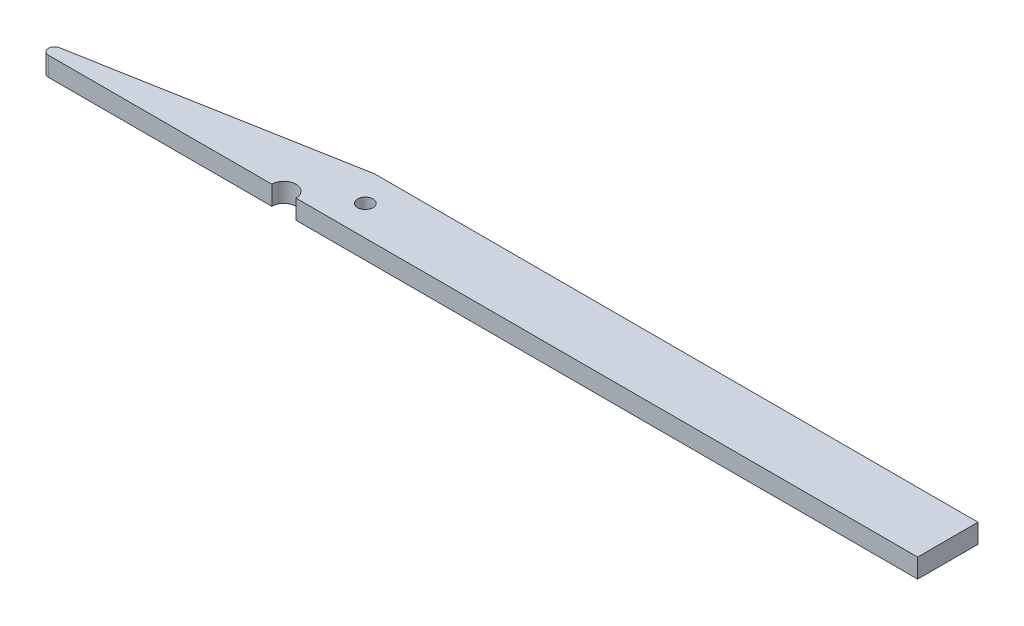
from build123d import *

# Parameters (mm, degrees)
BOSS_EXTRUDE1_DEPTH = 3.175
CUT_EXTRUDE1_REACH  = 227.249
SKETCH2_R           = 1.27
CUT_EXTRUDE2_DEPTH  = 226.248510263
SKETCH4_W           = 85
SKETCH4_H           = 10
CUT_EXTRUDE3_DEPTH  = 226.248510263


with BuildPart() as part:
    # Sketch1 → Boss-Extrude1 (new body)
    with BuildSketch(Plane(origin=(0, 0, 0), x_dir=(1, 0, 0), z_dir=(0, 1, 0))):
        with BuildLine():
            Line((0, 0), (-224.004023854, 0))
            ThreePointArc((-224.004023854, 0), (-225, 0.910381269), (-224.18254009, 1.983936966))
            Line((-224.18254009, 1.983936966), (-180, 10))
            Line((-180, 10), (0, 10))
            ThreePointArc((0, 10), (5, 5), (0, 0))
        make_face()
    extrude(amount=BOSS_EXTRUDE1_DEPTH)

    # Sketch2 → Cut-Extrude1 (cut, up to next)
    with BuildSketch(Plane(origin=(0, 3.175, 0), x_dir=(1, 0, 0), z_dir=(0, 1, 0)), mode=Mode.PRIVATE) as cut_extrude1_sk1:
        with Locations(Location((-50, 5, 0), (0, 0, 270))):
            Circle(SKETCH2_R)
    cut_extrude1_tool1 = extrude(cut_extrude1_sk1.sketch, amount=-CUT_EXTRUDE1_REACH, mode=Mode.PRIVATE) & part.part
    # Sketch2 → Cut-Extrude1 (cut, up to next)
    with BuildSketch(Plane(origin=(0, 3.175, 0), x_dir=(1, 0, 0), z_dir=(0, 1, 0)), mode=Mode.PRIVATE) as cut_extrude1_sk2:
        with Locations(Location((0, 5, 0), (0, 0, 270))):
            Circle(SKETCH2_R)
    cut_extrude1_tool2 = extrude(cut_extrude1_sk2.sketch, amount=-CUT_EXTRUDE1_REACH, mode=Mode.PRIVATE) & part.part
    # Sketch2 → Cut-Extrude1 (cut, up to next)
    with BuildSketch(Plane(origin=(0, 3.175, 0), x_dir=(1, 0, 0), z_dir=(0, 1, 0)), mode=Mode.PRIVATE) as cut_extrude1_sk3:
        with Locations(Location((-176.52, 5, 0), (0, 0, 270))):
            Circle(SKETCH2_R)
    cut_extrude1_tool3 = extrude(cut_extrude1_sk3.sketch, amount=-CUT_EXTRUDE1_REACH, mode=Mode.PRIVATE) & part.part
    add(cut_extrude1_tool1.solids().sort_by_distance((-50, 3.175, -5))[0], mode=Mode.SUBTRACT)
    add(cut_extrude1_tool2.solids().sort_by_distance((0, 3.175, -5))[0], mode=Mode.SUBTRACT)
    add(cut_extrude1_tool3.solids().sort_by_distance((-176.52, 3.175, -5))[0], mode=Mode.SUBTRACT)

    # Sketch3 → Cut-Extrude2 (cut, through all)
    with BuildSketch(Plane(origin=(0, 3.175, 0), x_dir=(1, 0, 0), z_dir=(0, 1, 0))):
        with BuildLine():
            Line((-187, 0), (-183, 0))
            ThreePointArc((-183, 0), (-185, 2), (-187, 0))
        make_face()
    extrude(amount=-CUT_EXTRUDE2_DEPTH, mode=Mode.SUBTRACT)

    # Sketch4 → Cut-Extrude3 (cut, through all)
    with BuildSketch(Plane.XZ):
        with Locations((-37.5, -5)):
            Rectangle(SKETCH4_W, SKETCH4_H)
    extrude(amount=-CUT_EXTRUDE3_DEPTH, mode=Mode.SUBTRACT)


solid = part.part
